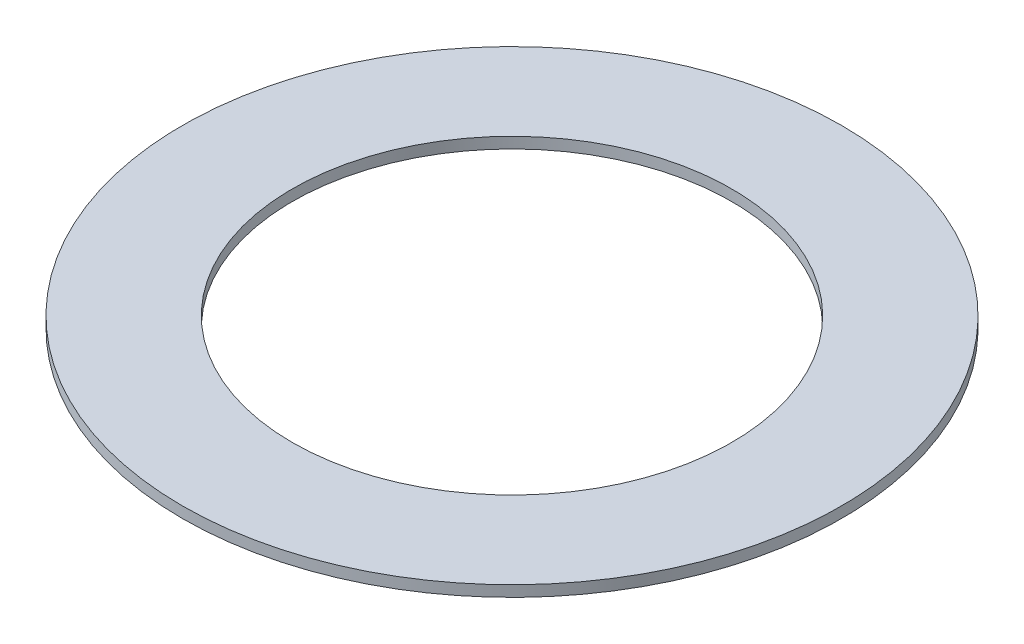
from build123d import *

# Parameters (mm, degrees)
SKETCH1_W = 2
SKETCH1_H = 0.2


with BuildPart() as part:
    # Sketch1 → Revolve1 (revolve)
    with BuildSketch(Plane(origin=(0, 0, 0), x_dir=(0, 0, -1), z_dir=(1, 0, 0)), mode=Mode.PRIVATE) as revolve1_sk:
        with Locations((5, 0)):
            Rectangle(SKETCH1_W, SKETCH1_H)
    revolve(revolve1_sk.sketch.rotate(Axis((0, 12.343867532, 0), (0, -1, 0)), 180), axis=Axis((0, 12.343867532, 0), (0, -1, 0)))


solid = part.part
